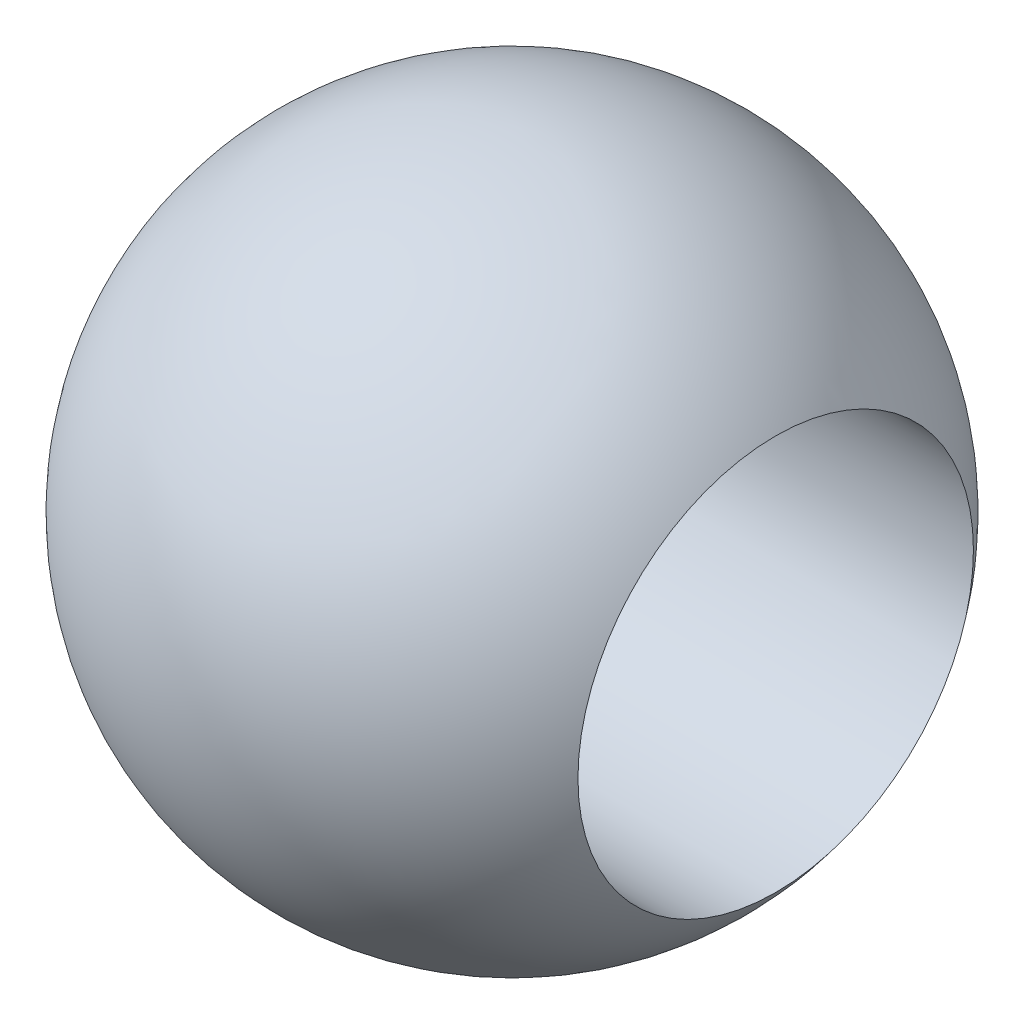
from build123d import *

# Parameters (mm, degrees)
CUT_EXTRUDE1_DEPTH      = 16.476293161
CUT_EXTRUDE1_DEPTH_BACK = 16.476293161
SKETCH2_W               = 2.54
SKETCH2_H               = 1.27


with BuildPart() as part:
    # Sketch1 → Revolve1 (revolve)
    with BuildSketch(Plane.XY):
        with BuildLine():
            Line((-7.62, 5.715), (7.62, 5.715))
            ThreePointArc((7.62, 5.715), (0, 9.525), (-7.62, 5.715))
        make_face()
    revolve(axis=Axis((-7.267344291, 0, 0), (1, 0, 0)))

    # Sketch2 → Cut-Extrude1 (cut, two sides: drawn at the far end of the back side and taken through both)
    with BuildSketch(Plane(origin=(0, 0, 0), x_dir=(1, 0, 0), z_dir=(0, 1, 0)).offset(-CUT_EXTRUDE1_DEPTH_BACK)):
        with Locations((0, 9.525)):
            Rectangle(SKETCH2_W, SKETCH2_H)
    extrude(amount=CUT_EXTRUDE1_DEPTH + CUT_EXTRUDE1_DEPTH_BACK, mode=Mode.SUBTRACT)


solid = part.part
